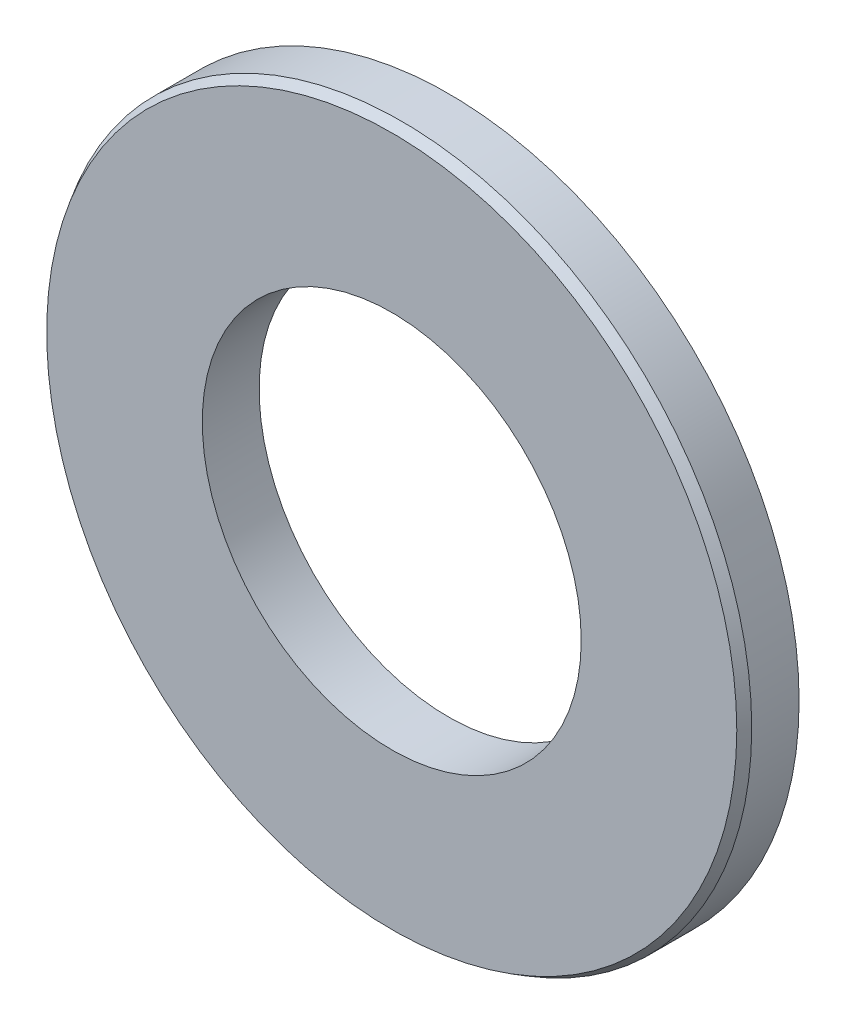
from build123d import *

# Parameters (mm, degrees)
SKETCH_1_R          = 18.5
EXTRUDE_2_DEPTH     = 3
SKETCH_2_R          = 10
CUT_EXTRUDE_1_DEPTH = 27.334388165
CHAMFER_1_SIZE      = 0.5
CHAMFER_1_SIZE2     = 0.288675135


with BuildPart() as part:
    # 草图1 → 拉伸2 (new body)
    with BuildSketch(Plane.XY):
        Circle(SKETCH_1_R)
    extrude(amount=EXTRUDE_2_DEPTH)

    # 草图2 → 切除-拉伸1 (cut, through all)
    with BuildSketch(Plane.XY.offset(3)):
        Circle(SKETCH_2_R)
    extrude(amount=-CUT_EXTRUDE_1_DEPTH, mode=Mode.SUBTRACT)

    # 倒角1
    chamfer_1_edges = [part.edges().sort_by_distance(p)[0] for p in [
        (-18.5, 0, 3),
    ]]
    chamfer_1_side = [part.faces().sort_by_distance(p)[0] for p in [
        (-18.5, 0, 1.5),
    ]]
    chamfer(chamfer_1_edges, length=CHAMFER_1_SIZE, length2=CHAMFER_1_SIZE2, reference=chamfer_1_side[0])


solid = part.part
